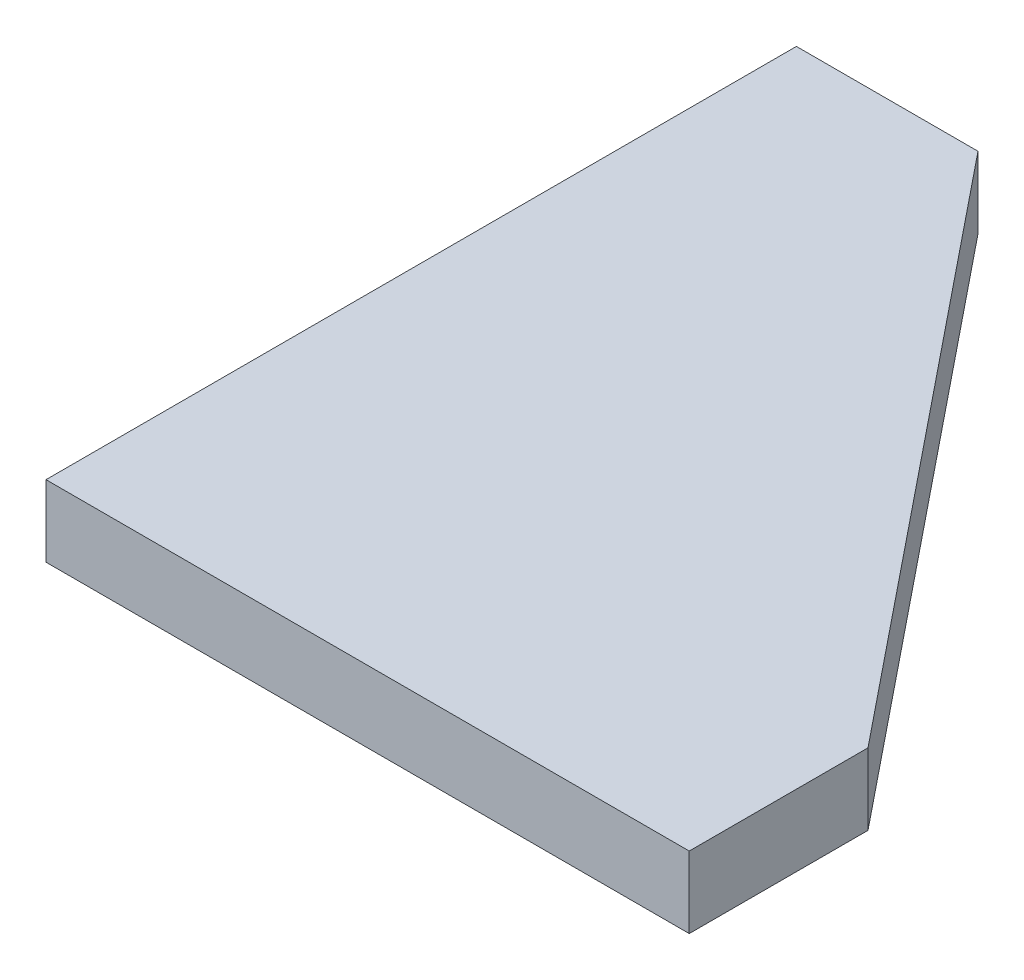
from build123d import *

# Parameters (mm, degrees)
EXTRUDE_1_DEPTH = 4


with BuildPart() as part:
    # Эскиз1 → Вытянуть1 (new body)
    with BuildSketch(Plane(origin=(0, 0, 0), x_dir=(1, 0, 0), z_dir=(0, 1, 0))):
        Polygon((10.158377506, 41.979959372), (35.983868539, 10.000000119), (35.983868539, 0), (0, 0), (0, 41.979959372), align=None)
    extrude(amount=EXTRUDE_1_DEPTH)


solid = part.part
